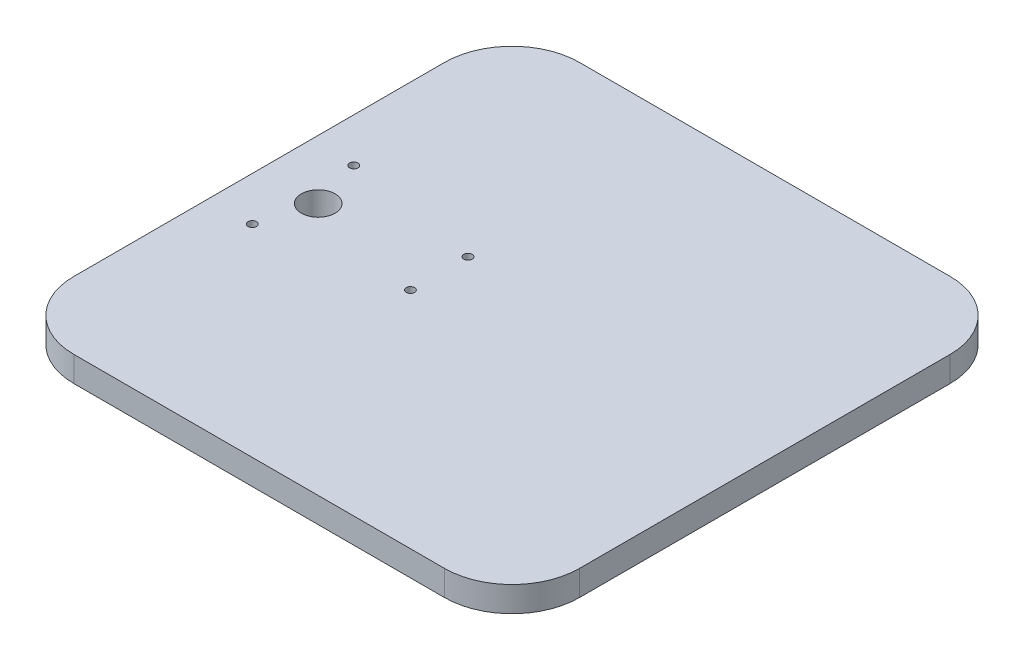
from build123d import *

# Parameters (mm, degrees)
SKETCH1_W               = 150
SKETCH1_H               = 150
BOSS_EXTRUDE1_DEPTH     = 7.5
CUT_EXTRUDE1_DEPTH      = 107.330851591
CUT_EXTRUDE1_DEPTH_BACK = 107.330851591
SKETCH2_R               = 1.25
SKETCH2_R_2             = 5
FILLET1_R               = 20


with BuildPart() as part:
    # Sketch1 → Boss-Extrude1 (new body)
    with BuildSketch(Plane(origin=(0, 0, 0), x_dir=(1, 0, 0), z_dir=(0, 1, 0))):
        Rectangle(SKETCH1_W, SKETCH1_H)
    extrude(amount=BOSS_EXTRUDE1_DEPTH)

    # Sketch2 → Cut-Extrude1 (cut, two sides: drawn at the far end of the back side and taken through both)
    with BuildSketch(Plane(origin=(0, 7.5, 0), x_dir=(1, 0, 0), z_dir=(0, 1, 0)).offset(-CUT_EXTRUDE1_DEPTH_BACK)):
        with Locations(Location((-61.985746634, -15.05, 0), (0, 0, 270))):
            Circle(SKETCH2_R)
        with Locations(Location((-61.985746634, 15.05, 0), (0, 0, 270))):
            Circle(SKETCH2_R)
        with Locations(Location((-21.585746634, 8.55, 0), (0, 0, 270))):
            Circle(SKETCH2_R)
        with Locations(Location((-21.585746634, -8.55, 0), (0, 0, 270))):
            Circle(SKETCH2_R)
        with Locations(Location((-57.485746634, 0, 0), (0, 0, 270))):
            Circle(SKETCH2_R_2)
    extrude(amount=CUT_EXTRUDE1_DEPTH + CUT_EXTRUDE1_DEPTH_BACK, mode=Mode.SUBTRACT)

    # Fillet1
    fillet1_edges = [part.edges().sort_by_distance(p)[0] for p in [
        (-75, 3.75, -75),
        (75, 3.75, -75),
        (75, 3.75, 75),
        (-75, 3.75, 75),
    ]]
    fillet(fillet1_edges, radius=FILLET1_R)


solid = part.part
